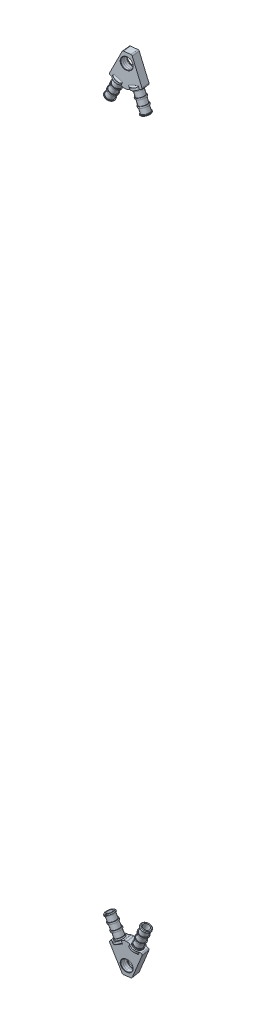
from build123d import *

# Parameters (mm, degrees)
BOSS_EXTRUDE1_DEPTH     = 6
FILLET1_R               = 2
SKETCH2_R               = 9.000000000000037
BOSS_EXTRUDE2_DEPTH     = 3
SKETCH4_R               = 5.999999999999989
BOSS_EXTRUDE4_DEPTH     = 31
SKETCH7_R               = 7.000000000000042
SKETCH7_R_2             = 6.0000000000002185
BOSS_EXTRUDE5_DEPTH     = 2
LPATTERN1_COUNT         = 4
LPATTERN1_PITCH         = 9.666666666666666
CHAMFER1_SIZE           = 1
SKETCH10_R              = 8.999999999999813
BOSS_EXTRUDE6_DEPTH     = 3
SKETCH11_R              = 6.000000000000097
BOSS_EXTRUDE7_DEPTH     = 31
SKETCH12_R              = 6.999999999999927
SKETCH12_R_2            = 6.000000000000561
BOSS_EXTRUDE8_DEPTH     = 2
LPATTERN2_COUNT         = 4
LPATTERN2_PITCH         = 9.666666666666666
CHAMFER2_SIZE           = 1
FILLET2_R               = 2
CHAMFER3_SIZE           = 0.5
CUT_EXTRUDE1_DEPTH      = 3
CUT_EXTRUDE1_DEPTH_BACK = 2
SKETCH14_R              = 7.999999999999987
CUT_EXTRUDE2_START      = -2.5
SKETCH15_R              = 8.75000000000004
CUT_EXTRUDE2_DEPTH      = 1.05


with BuildPart() as part:
    # Sketch1 → Boss-Extrude1 (new, symmetric)
    with BuildSketch(Plane(origin=(40.22848605021182, 10.507440386249398, 304.21541689712456), x_dir=(0.9913798815676159, -0.004522624098671365, -0.13094073580915158), z_dir=(0.13101881705686366, 0.03422133281336, 0.9907890643106118))):
        with BuildLine():
            Line((1125.7923568942253, 582.4609465073789), (1113.5581017730187, 582.460946507379))
            Line((1113.5581017730187, 582.460946507379), (1096.8813358766208, 546.245672674871))
            Line((1096.8813358766208, 546.245672674871), (1106.8728718457214, 541.6446718078677))
            Line((1106.8728718457214, 541.6446718078674), (1116.074873579728, 561.6277437460691))
            ThreePointArc((1116.0748735797279, 561.6277437460692), (1115.106514314083, 575.631134327019), (1127.4210560284578, 568.8943153599605))
            ThreePointArc((1127.4210560284578, 568.8943153599605), (1126.0556576867325, 564.424185514417), (1122.425540819453, 561.479932638474))
            Line((1122.425540819453, 561.4799326384739), (1130.68787399469, 541.090380154386))
            Line((1130.68787399469, 541.090380154386), (1140.8826502367342, 545.2215467420046))
            Line((1140.8826502367342, 545.2215467420046), (1125.7923568942253, 582.4609465073789))
        make_face()
        with BuildLine():
            Line((1116.074873579728, 561.6277437460691), (1106.8728718457214, 541.6446718078674))
            Line((1106.8728718457214, 541.6446718078677), (1116.8644078148222, 537.0436709408642))
            Line((1116.8644078148222, 537.0436709408642), (1120.4930977526462, 536.9592135667675))
            Line((1120.4930977526462, 536.9592135667675), (1130.68787399469, 541.090380154386))
            Line((1130.68787399469, 541.090380154386), (1122.425540819453, 561.4799326384739))
            ThreePointArc((1122.425540819453, 561.479932638474), (1119.2349072889845, 560.896481362759), (1116.0748735797279, 561.6277437460692))
        make_face()
    extrude(amount=BOSS_EXTRUDE1_DEPTH, both=True)

    # Fillet1
    fillet1_edges = [part.edges().sort_by_distance(p)[0] for p in [
        (1147.4653903967558, 542.1798998731624, 139.43421828086267),
        (1128.0476313564752, 551.5694575543945, 144.70554073394916),
        (1144.580641555777, 587.6877259897925, 141.2717616925557),
        (1155.9233230465654, 587.4270670558717, 133.72506493904436),
        (1170.8835362732825, 550.1416125523617, 133.03459355934973),
        (1151.0628005975614, 542.0790816312547, 138.96199032516412),
    ]]
    fillet(fillet1_edges, radius=FILLET1_R)

    # Sketch2 → Boss-Extrude2 (add)
    with BuildSketch(Plane(origin=(395.9915846248843, 865.0893079497423, -82.24440603747578), x_dir=(-0.9099731182582202, 0.41280589206970897, -0.03924563058409188), z_dir=(-0.41466724496566065, -0.9058884428480648, 0.08612319703132973))):
        with Locations((-814.9344009695442, -191.70601494572279)):
            Circle(SKETCH2_R)
    extrude(amount=-BOSS_EXTRUDE2_DEPTH)

    # Sketch4 → Boss-Extrude4 (add)
    with BuildSketch(Plane(origin=(395.9915846248843, 865.0893079497423, -82.24440603747578), x_dir=(-0.9099731182582202, 0.41280589206970897, -0.03924563058409188), z_dir=(-0.41466724496566065, -0.9058884428480648, 0.08612319703132973))):
        with Locations(Location((-814.9344009695399, -191.7060149457234, 0), (0, 0, 177.742421012))):
            Circle(SKETCH4_R)
    extrude(amount=BOSS_EXTRUDE4_DEPTH)

    # Sketch7 → Boss-Extrude5 (add)
    with BuildSketch(Plane(origin=(395.9915846248843, 865.0893079497423, -82.24440603747578), x_dir=(-0.9099731182582202, 0.41280589206970897, -0.03924563058409188), z_dir=(-0.41466724496566065, -0.9058884428480648, 0.08612319703132973))):
        with Locations(Location((-814.9344009695399, -191.7060149457234, 0), (0, 0, 177.742421012))):
            Circle(SKETCH7_R)
        with Locations(Location((-814.9344009695399, -191.7060149457234, 0), (0, 0, 177.742421012))):
            Circle(SKETCH7_R_2, mode=Mode.SUBTRACT)
    boss_extrude5 = extrude(amount=BOSS_EXTRUDE5_DEPTH)

    # LPattern1: Boss-Extrude5 ×4
    with Locations(*[Vector(-0.41466724496565566, -0.9058884428480669, 0.08612319703133149) * (i * LPATTERN1_PITCH) for i in range(1, LPATTERN1_COUNT)]):
        add(boss_extrude5)

    # Chamfer1
    chamfer1_edges = [part.edges().sort_by_distance(p)[0] for p in [
        (1118.3404302588897, 521.654300809395, 143.25351501891666),
    ]]
    chamfer(chamfer1_edges, length=CHAMFER1_SIZE)

    # Sketch9 → Cut-Revolve1 (revolve, cut)
    with BuildSketch(Plane(origin=(701.3399119759364, -328.7734016214342, -81.38731494870906), x_dir=(0.09461756399583972, -0.04435472420271057, 0.9945251002485532), z_dir=(-0.900491613247789, 0.42213153103599016, 0.10449796637066838))):
        with BuildLine():
            Line((225.877486562659, 947.0804844817654), (230.36058184932747, 947.4701723705318))
            Line((230.36058184932747, 947.4701723705318), (228.51317259887966, 968.7233648406637))
            ThreePointArc((228.51317259887966, 968.7233648406637), (226.92455344142695, 971.779254978499), (223.64038942344484, 972.8167722385658))
            Line((223.64038942344484, 972.8167722385658), (225.877486562659, 947.0804844817654))
        make_face()
    revolve(axis=Axis((1135.417535218711, 542.1429230931792, 141.0286657622679), (-0.41466724496565976, -0.9058884428480652, 0.08612319703132981)), mode=Mode.SUBTRACT)

    # Sketch10 → Boss-Extrude6 (add)
    with BuildSketch(Plane(origin=(-28.60916021936566, 71.30283008518833, 1.3204227793553287), x_dir=(-0.9281031291481225, -0.3722593970186158, -0.006893692537381721), z_dir=(0.3723232220335758, -0.9279440302990668, -0.017184148709241842))):
        with Locations((-1281.9468219791854, -127.34853607341212)):
            Circle(SKETCH10_R)
    extrude(amount=-BOSS_EXTRUDE6_DEPTH)

    # Sketch11 → Boss-Extrude7 (add)
    with BuildSketch(Plane(origin=(-28.60916021936566, 71.30283008518833, 1.3204227793553287), x_dir=(-0.9281031291481225, -0.3722593970186158, -0.006893692537381721), z_dir=(0.3723232220335758, -0.9279440302990668, -0.017184148709241842))):
        with Locations(Location((-1281.9468219791854, -127.34853607341212, 0), (0, 0, 179.604959052))):
            Circle(SKETCH11_R)
    extrude(amount=BOSS_EXTRUDE7_DEPTH)

    # Sketch12 → Boss-Extrude8 (add)
    with BuildSketch(Plane(origin=(-28.60916021936566, 71.30283008518833, 1.3204227793553287), x_dir=(-0.9281031291481225, -0.3722593970186158, -0.006893692537381721), z_dir=(0.3723232220335758, -0.9279440302990668, -0.017184148709241842))):
        with Locations(Location((-1281.9468219791854, -127.34853607341212, 0), (0, 0, 179.604959052))):
            Circle(SKETCH12_R)
        with Locations(Location((-1281.9468219791854, -127.34853607341212, 0), (0, 0, 179.604959052))):
            Circle(SKETCH12_R_2, mode=Mode.SUBTRACT)
    boss_extrude8 = extrude(amount=BOSS_EXTRUDE8_DEPTH)

    # LPattern2: Boss-Extrude8 ×4
    with Locations(*[Vector(0.3723232220336152, -0.9279440302990509, -0.01718414870924285) * (i * LPATTERN2_PITCH) for i in range(1, LPATTERN2_COUNT)]):
        add(boss_extrude8)

    # Chamfer2
    chamfer2_edges = [part.edges().sort_by_distance(p)[0] for p in [
        (1166.2151490592937, 514.788766704171, 136.95176692871334),
    ]]
    chamfer(chamfer2_edges, length=CHAMFER2_SIZE)

    # Sketch13 → Cut-Revolve2 (revolve, cut)
    with BuildSketch(Plane(origin=(1149.5503708301608, 464.3514086195921, -168.0513641377568), x_dir=(0.37232322203357693, -0.9279440302990664, -0.01718414870924198), z_dir=(0.9188087330405366, 0.37114522361577396, -0.1343195260401155)), mode=Mode.PRIVATE) as cut_revolve2_sk:
        with BuildLine():
            Line((-45.83958057492598, -307.04357552512596), (-45.83958057492598, -302.54357552512596))
            Line((-45.83958057492598, -302.54357552512596), (-67.17291390825942, -302.54357552512596))
            ThreePointArc((-67.17291390825942, -302.54357552512596), (-70.35489442359888, -303.86159500978647), (-71.67291390825942, -307.04357552512596))
            Line((-71.67291390825942, -307.04357552512596), (-45.83958057492598, -307.04357552512596))
        make_face()
    revolve(cut_revolve2_sk.sketch.rotate(Axis((1163.0933666415144, 541.3673016011497, 137.3956907703916), (0.37232322203357254, -0.927944030299068, -0.017184148709241166)), 277.720420161), axis=Axis((1163.0933666415144, 541.3673016011497, 137.3956907703916), (0.37232322203357254, -0.927944030299068, -0.017184148709241166)), mode=Mode.SUBTRACT)

    # Fillet2
    fillet2_edges = [part.edges().sort_by_distance(p)[0] for p in [
        (1159.2666140925658, 548.7401831850455, 131.59129359898685),
        (1160.8388398972481, 549.1508391788058, 143.4807623707142),
        (1138.0178714835909, 549.335684046224, 134.38059193398155),
        (1139.5900972882732, 549.7463400399843, 146.27006070570894),
    ]]
    fillet(fillet2_edges, radius=FILLET2_R)

    # Chamfer3
    chamfer3_edges = [part.edges().sort_by_distance(p)[0] for p in [
        (1146.5087630485255, 580.9576451769952, 144.27713614156175),
        (1144.9365372438433, 580.5469891832349, 132.3876673698344),
    ]]
    chamfer(chamfer3_edges, length=CHAMFER3_SIZE)

    # Sketch14 → Cut-Extrude1 (cut, two sides: drawn at the far end of the back side and taken through both)
    with BuildSketch(Plane.XY.offset(138).offset(-CUT_EXTRUDE1_DEPTH_BACK)):
        with Locations((1150, 574.0000000000001)):
            Circle(SKETCH14_R)
    extrude(amount=CUT_EXTRUDE1_DEPTH + CUT_EXTRUDE1_DEPTH_BACK, mode=Mode.SUBTRACT)

    # Sketch15 → Cut-Extrude2 (cut)
    with BuildSketch(Plane.XY.offset(138).offset(CUT_EXTRUDE2_START)):
        with Locations((1150, 574.0000000000001)):
            Circle(SKETCH15_R)
    extrude(amount=-CUT_EXTRUDE2_DEPTH, mode=Mode.SUBTRACT)


with BuildPart() as body_2:
    # 镜向1: mirrored copy
    add(part.part.mirror(Plane.ZX))


solid = Compound([part.part, body_2.part])
